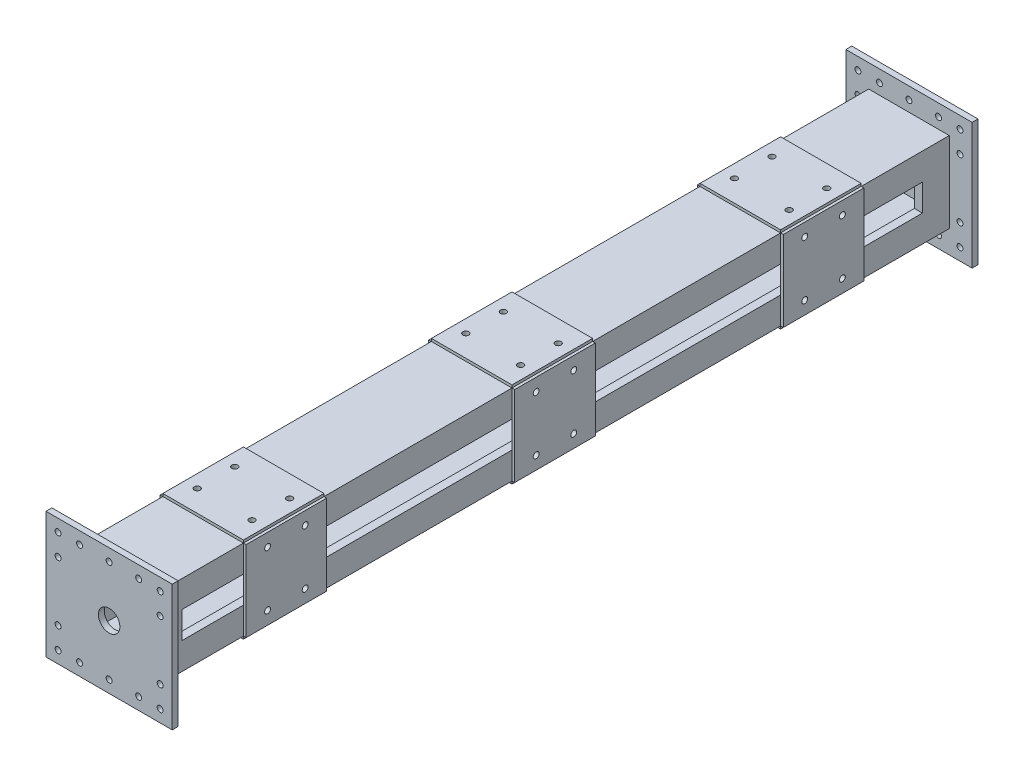
from build123d import *

# Parameters (mm, degrees)
SKETCH_1_W                       = 300
SKETCH_1_H                       = 300
EXTRUDE_1_DEPTH                  = 2956
SKETCH_2_W                       = 240
SKETCH_2_H                       = 240
CUT_EXTRUDE_1_DEPTH              = 2987.291345465
SKETCH_4_W                       = 2756
SKETCH_4_H                       = 100
CUT_EXTRUDE_2_DEPTH              = 2987.291345465
SKETCH_5_W                       = 470
SKETCH_5_H                       = 470
EXTRUDE_2_DEPTH                  = 22
SKETCH_6_W                       = 470
SKETCH_6_H                       = 470
EXTRUDE_3_DEPTH                  = 22
SKETCH_7_R                       = 11
CUT_EXTRUDE_3_DEPTH              = 3050.008035411
SKETCH_8_W                       = 300
SKETCH_8_H                       = 300
EXTRUDE_4_DEPTH                  = 10
SKETCH_10_W                      = 300
SKETCH_10_H                      = 300
EXTRUDE_5_DEPTH                  = 10
SKETCH_11_W                      = 300
SKETCH_11_H                      = 300
EXTRUDE_6_DEPTH                  = 10
SKETCH_12_W                      = 300
SKETCH_12_H                      = 300
EXTRUDE_7_DEPTH                  = 10
SKETCH_13_R                      = 11
CUT_EXTRUDE_4_DEPTH              = 3029.652175473
PATTERN_LINEAR_1_COUNT           = 2
PATTERN_LINEAR_1_PITCH           = 204
PATTERN_LINEAR_1_COUNT_DIR2      = 2
PATTERN_LINEAR_1_PITCH_DIR2      = 140
PATTERN_LINEAR_2_COUNT           = 3
PATTERN_LINEAR_2_PITCH           = 1000
PATTERN_LINEAR_2_COPY_1_SKETCH_R = 11
PATTERN_LINEAR_2_COPY_1_DEPTH    = 3029.652175473
PATTERN_LINEAR_2_COPY_2_SKETCH_R = 11
PATTERN_LINEAR_2_COPY_2_DEPTH    = 3029.652175473
PATTERN_LINEAR_2_COPY_3_SKETCH_R = 11
PATTERN_LINEAR_2_COPY_3_DEPTH    = 3029.652175473
PATTERN_LINEAR_2_COPY_4_SKETCH_R = 11
PATTERN_LINEAR_2_COPY_4_DEPTH    = 3029.652175473
PATTERN_LINEAR_2_COPY_5_SKETCH_R = 11
PATTERN_LINEAR_2_COPY_5_DEPTH    = 3029.652175473
PATTERN_LINEAR_2_COPY_6_SKETCH_R = 11
PATTERN_LINEAR_2_COPY_6_DEPTH    = 3029.652175473
SKETCH_14_R                      = 11
CUT_EXTRUDE_5_DEPTH              = 3029.652175473
PATTERN_LINEAR_3_COUNT           = 2
PATTERN_LINEAR_3_PITCH           = 140
PATTERN_LINEAR_3_COUNT_DIR2      = 2
PATTERN_LINEAR_3_PITCH_DIR2      = 204
PATTERN_LINEAR_4_COUNT           = 3
PATTERN_LINEAR_4_PITCH           = 1000
PATTERN_LINEAR_4_COPY_1_SKETCH_R = 11
PATTERN_LINEAR_4_COPY_1_DEPTH    = 3029.652175473
PATTERN_LINEAR_4_COPY_2_SKETCH_R = 11
PATTERN_LINEAR_4_COPY_2_DEPTH    = 3029.652175473
PATTERN_LINEAR_4_COPY_3_SKETCH_R = 11
PATTERN_LINEAR_4_COPY_3_DEPTH    = 3029.652175473
PATTERN_LINEAR_4_COPY_4_SKETCH_R = 11
PATTERN_LINEAR_4_COPY_4_DEPTH    = 3029.652175473
PATTERN_LINEAR_4_COPY_5_SKETCH_R = 11
PATTERN_LINEAR_4_COPY_5_DEPTH    = 3029.652175473
PATTERN_LINEAR_4_COPY_6_SKETCH_R = 11
PATTERN_LINEAR_4_COPY_6_DEPTH    = 3029.652175473
SKETCH_15_R                      = 40
CUT_EXTRUDE_6_DEPTH              = 3050.008035411


with BuildPart() as part:
    # 草图1 → 拉伸1 (new body)
    with BuildSketch(Plane.XY):
        with Locations((150, 150)):
            Rectangle(SKETCH_1_W, SKETCH_1_H)
    extrude(amount=EXTRUDE_1_DEPTH)

    # 草图2 → 切除-拉伸1 (cut, through all)
    with BuildSketch(Plane.XY.offset(2956)):
        with Locations((150, 150)):
            Rectangle(SKETCH_2_W, SKETCH_2_H)
    extrude(amount=-CUT_EXTRUDE_1_DEPTH, mode=Mode.SUBTRACT)

    # 草图4 → 切除-拉伸2 (cut, through all)
    with BuildSketch(Plane.ZY):
        with Locations((1478, 150)):
            Rectangle(SKETCH_4_W, SKETCH_4_H)
    extrude(amount=-CUT_EXTRUDE_2_DEPTH, mode=Mode.SUBTRACT)

    # 草图5 → 拉伸2 (add)
    with BuildSketch(Plane.XY.offset(2956)):
        with Locations((150, 150)):
            Rectangle(SKETCH_5_W, SKETCH_5_H)
    extrude(amount=EXTRUDE_2_DEPTH)

    # 草图6 → 拉伸3 (add)
    with BuildSketch(Plane(origin=(0, 0, 0), x_dir=(-1, 0, 0), z_dir=(0, 0, -1))):
        with Locations((-150, 150)):
            Rectangle(SKETCH_6_W, SKETCH_6_H)
    extrude(amount=EXTRUDE_3_DEPTH)

    # 草图7 → 切除-拉伸3 (cut, through all)
    with BuildSketch(Plane.XY.offset(2978)):
        with Locations((-40, -40)):
            Circle(SKETCH_7_R)
        with Locations((40, -40)):
            Circle(SKETCH_7_R)
        with Locations((150, -40)):
            Circle(SKETCH_7_R)
        with Locations((260, -40)):
            Circle(SKETCH_7_R)
        with Locations((340, -40)):
            Circle(SKETCH_7_R)
        with Locations((-40, 340)):
            Circle(SKETCH_7_R)
        with Locations((40, 340)):
            Circle(SKETCH_7_R)
        with Locations((150, 340)):
            Circle(SKETCH_7_R)
        with Locations((260, 340)):
            Circle(SKETCH_7_R)
        with Locations((340, 340)):
            Circle(SKETCH_7_R)
        with Locations((-40, 40)):
            Circle(SKETCH_7_R)
        with Locations((-40, 260)):
            Circle(SKETCH_7_R)
        with Locations((340, 40)):
            Circle(SKETCH_7_R)
        with Locations((340, 260)):
            Circle(SKETCH_7_R)
    extrude(amount=-CUT_EXTRUDE_3_DEPTH, mode=Mode.SUBTRACT)

    # 草图8 → 拉伸4 (add)
    with BuildSketch(Plane(origin=(0, 300, 0), x_dir=(1, 0, 0), z_dir=(0, 1, 0))):
        with Locations((150, -478)):
            Rectangle(SKETCH_8_W, SKETCH_8_H)
        with Locations((150, -1478)):
            Rectangle(SKETCH_8_W, SKETCH_8_H)
        with Locations((150, -2478)):
            Rectangle(SKETCH_8_W, SKETCH_8_H)
    extrude(amount=EXTRUDE_4_DEPTH)

    # 草图10 → 拉伸5 (add)
    with BuildSketch(Plane.XZ):
        with Locations((150, 478)):
            Rectangle(SKETCH_10_W, SKETCH_10_H)
        with Locations((150, 1478)):
            Rectangle(SKETCH_10_W, SKETCH_10_H)
        with Locations((150, 2478)):
            Rectangle(SKETCH_10_W, SKETCH_10_H)
    extrude(amount=EXTRUDE_5_DEPTH)

    # 草图11 → 拉伸6 (add)
    with BuildSketch(Plane(origin=(300, 0, 0), x_dir=(0, 0, -1), z_dir=(1, 0, 0))):
        with Locations((-478, 150)):
            Rectangle(SKETCH_11_W, SKETCH_11_H)
        with Locations((-1478, 150)):
            Rectangle(SKETCH_11_W, SKETCH_11_H)
        with Locations((-2478, 150)):
            Rectangle(SKETCH_11_W, SKETCH_11_H)
    extrude(amount=EXTRUDE_6_DEPTH)

    # 草图12 → 拉伸7 (add)
    with BuildSketch(Plane.ZY):
        with Locations((478, 150)):
            Rectangle(SKETCH_12_W, SKETCH_12_H)
        with Locations((1478, 150)):
            Rectangle(SKETCH_12_W, SKETCH_12_H)
        with Locations((2478, 150)):
            Rectangle(SKETCH_12_W, SKETCH_12_H)
    extrude(amount=EXTRUDE_7_DEPTH)

    # 草图13 → 切除-拉伸4 (cut, through all)
    with BuildSketch(Plane.XZ.offset(10)):
        with Locations(Location((48, 2548, 0), (0, 0, 270))):
            Circle(SKETCH_13_R)
    cut_extrude_4 = extrude(amount=-CUT_EXTRUDE_4_DEPTH, mode=Mode.SUBTRACT)

    # 阵列(线性)1: Cut-Extrude 4 2 × 2
    with Locations(*[(i * PATTERN_LINEAR_1_PITCH, 0, -j * PATTERN_LINEAR_1_PITCH_DIR2) for i in range(PATTERN_LINEAR_1_COUNT) for j in range(PATTERN_LINEAR_1_COUNT_DIR2) if (i, j) != (0, 0)]):
        add(cut_extrude_4, mode=Mode.SUBTRACT)

    # 阵列(线性)2: 切除-拉伸4 ×3
    with Locations(*[(0, 0, -i * PATTERN_LINEAR_2_PITCH) for i in range(1, PATTERN_LINEAR_2_COUNT)]):
        add(cut_extrude_4, mode=Mode.SUBTRACT)

    # 阵列(线性)2 copy 1 sketch → 阵列(线性)2 copy 1 (cut, through all)
    with BuildSketch(Plane(origin=(0, -10, -1140), x_dir=(1, 0, 0), z_dir=(0, -1, 0))):
        with Locations(Location((48, 2548, 0), (0, 0, 270))):
            Circle(PATTERN_LINEAR_2_COPY_1_SKETCH_R)
    extrude(amount=-PATTERN_LINEAR_2_COPY_1_DEPTH, mode=Mode.SUBTRACT)

    # 阵列(线性)2 copy 2 sketch → 阵列(线性)2 copy 2 (cut, through all)
    with BuildSketch(Plane(origin=(0, -10, -2140), x_dir=(1, 0, 0), z_dir=(0, -1, 0))):
        with Locations(Location((48, 2548, 0), (0, 0, 270))):
            Circle(PATTERN_LINEAR_2_COPY_2_SKETCH_R)
    extrude(amount=-PATTERN_LINEAR_2_COPY_2_DEPTH, mode=Mode.SUBTRACT)

    # 阵列(线性)2 copy 3 sketch → 阵列(线性)2 copy 3 (cut, through all)
    with BuildSketch(Plane(origin=(204, -10, -1000), x_dir=(1, 0, 0), z_dir=(0, -1, 0))):
        with Locations(Location((48, 2548, 0), (0, 0, 270))):
            Circle(PATTERN_LINEAR_2_COPY_3_SKETCH_R)
    extrude(amount=-PATTERN_LINEAR_2_COPY_3_DEPTH, mode=Mode.SUBTRACT)

    # 阵列(线性)2 copy 4 sketch → 阵列(线性)2 copy 4 (cut, through all)
    with BuildSketch(Plane(origin=(204, -10, -2000), x_dir=(1, 0, 0), z_dir=(0, -1, 0))):
        with Locations(Location((48, 2548, 0), (0, 0, 270))):
            Circle(PATTERN_LINEAR_2_COPY_4_SKETCH_R)
    extrude(amount=-PATTERN_LINEAR_2_COPY_4_DEPTH, mode=Mode.SUBTRACT)

    # 阵列(线性)2 copy 5 sketch → 阵列(线性)2 copy 5 (cut, through all)
    with BuildSketch(Plane(origin=(204, -10, -1140), x_dir=(1, 0, 0), z_dir=(0, -1, 0))):
        with Locations(Location((48, 2548, 0), (0, 0, 270))):
            Circle(PATTERN_LINEAR_2_COPY_5_SKETCH_R)
    extrude(amount=-PATTERN_LINEAR_2_COPY_5_DEPTH, mode=Mode.SUBTRACT)

    # 阵列(线性)2 copy 6 sketch → 阵列(线性)2 copy 6 (cut, through all)
    with BuildSketch(Plane(origin=(204, -10, -2140), x_dir=(1, 0, 0), z_dir=(0, -1, 0))):
        with Locations(Location((48, 2548, 0), (0, 0, 270))):
            Circle(PATTERN_LINEAR_2_COPY_6_SKETCH_R)
    extrude(amount=-PATTERN_LINEAR_2_COPY_6_DEPTH, mode=Mode.SUBTRACT)

    # 草图14 → 切除-拉伸5 (cut, through all)
    with BuildSketch(Plane(origin=(310, 0, 0), x_dir=(0, 0, -1), z_dir=(1, 0, 0))):
        with Locations((-2548, 48)):
            Circle(SKETCH_14_R)
    cut_extrude_5 = extrude(amount=-CUT_EXTRUDE_5_DEPTH, mode=Mode.SUBTRACT)

    # 阵列(线性)3: Cut-Extrude 5 2 × 2
    with Locations(*[(0, j * PATTERN_LINEAR_3_PITCH_DIR2, -i * PATTERN_LINEAR_3_PITCH) for i in range(PATTERN_LINEAR_3_COUNT) for j in range(PATTERN_LINEAR_3_COUNT_DIR2) if (i, j) != (0, 0)]):
        add(cut_extrude_5, mode=Mode.SUBTRACT)

    # 阵列(线性)4: 切除-拉伸5 ×3
    with Locations(*[(0, 0, -i * PATTERN_LINEAR_4_PITCH) for i in range(1, PATTERN_LINEAR_4_COUNT)]):
        add(cut_extrude_5, mode=Mode.SUBTRACT)

    # 阵列(线性)4 copy 1 sketch → 阵列(线性)4 copy 1 (cut, through all)
    with BuildSketch(Plane(origin=(310, 204, -1000), x_dir=(0, 0, -1), z_dir=(1, 0, 0))):
        with Locations((-2548, 48)):
            Circle(PATTERN_LINEAR_4_COPY_1_SKETCH_R)
    extrude(amount=-PATTERN_LINEAR_4_COPY_1_DEPTH, mode=Mode.SUBTRACT)

    # 阵列(线性)4 copy 2 sketch → 阵列(线性)4 copy 2 (cut, through all)
    with BuildSketch(Plane(origin=(310, 204, -2000), x_dir=(0, 0, -1), z_dir=(1, 0, 0))):
        with Locations((-2548, 48)):
            Circle(PATTERN_LINEAR_4_COPY_2_SKETCH_R)
    extrude(amount=-PATTERN_LINEAR_4_COPY_2_DEPTH, mode=Mode.SUBTRACT)

    # 阵列(线性)4 copy 3 sketch → 阵列(线性)4 copy 3 (cut, through all)
    with BuildSketch(Plane(origin=(310, 0, -1140), x_dir=(0, 0, -1), z_dir=(1, 0, 0))):
        with Locations((-2548, 48)):
            Circle(PATTERN_LINEAR_4_COPY_3_SKETCH_R)
    extrude(amount=-PATTERN_LINEAR_4_COPY_3_DEPTH, mode=Mode.SUBTRACT)

    # 阵列(线性)4 copy 4 sketch → 阵列(线性)4 copy 4 (cut, through all)
    with BuildSketch(Plane(origin=(310, 0, -2140), x_dir=(0, 0, -1), z_dir=(1, 0, 0))):
        with Locations((-2548, 48)):
            Circle(PATTERN_LINEAR_4_COPY_4_SKETCH_R)
    extrude(amount=-PATTERN_LINEAR_4_COPY_4_DEPTH, mode=Mode.SUBTRACT)

    # 阵列(线性)4 copy 5 sketch → 阵列(线性)4 copy 5 (cut, through all)
    with BuildSketch(Plane(origin=(310, 204, -1140), x_dir=(0, 0, -1), z_dir=(1, 0, 0))):
        with Locations((-2548, 48)):
            Circle(PATTERN_LINEAR_4_COPY_5_SKETCH_R)
    extrude(amount=-PATTERN_LINEAR_4_COPY_5_DEPTH, mode=Mode.SUBTRACT)

    # 阵列(线性)4 copy 6 sketch → 阵列(线性)4 copy 6 (cut, through all)
    with BuildSketch(Plane(origin=(310, 204, -2140), x_dir=(0, 0, -1), z_dir=(1, 0, 0))):
        with Locations((-2548, 48)):
            Circle(PATTERN_LINEAR_4_COPY_6_SKETCH_R)
    extrude(amount=-PATTERN_LINEAR_4_COPY_6_DEPTH, mode=Mode.SUBTRACT)

    # 草图15 → 切除-拉伸6 (cut, through all)
    with BuildSketch(Plane.XY.offset(2978)):
        with Locations((150, 150)):
            Circle(SKETCH_15_R)
    extrude(amount=-CUT_EXTRUDE_6_DEPTH, mode=Mode.SUBTRACT)


solid = part.part
